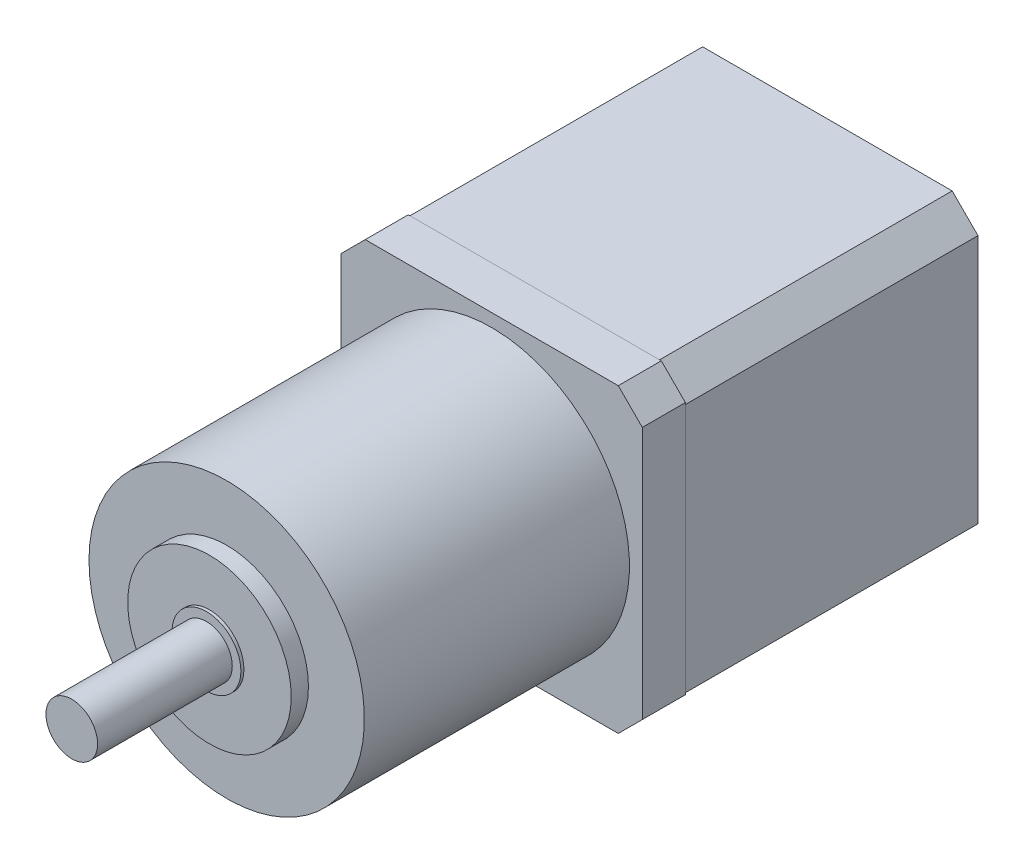
from build123d import *

# Parameters (mm, degrees)
SKETCH1_W           = 35
SKETCH1_H           = 35
BOSS_EXTRUDE1_DEPTH = 34
CHAMFER1_SIZE       = 3
SKETCH2_W           = 35
SKETCH2_H           = 35
BOSS_EXTRUDE2_DEPTH = 5
CHAMFER2_SIZE       = 2.8
SKETCH3_R           = 16
BOSS_EXTRUDE3_DEPTH = 30.8
SKETCH4_R           = 9.5
BOSS_EXTRUDE4_DEPTH = 2
SKETCH6_R           = 3
BOSS_EXTRUDE5_DEPTH = 18
SKETCH7_R           = 4
BOSS_EXTRUDE6_DEPTH = 0.35


with BuildPart() as part:
    # Sketch1 → Boss-Extrude1 (new body)
    with BuildSketch(Plane.XY):
        Rectangle(SKETCH1_W, SKETCH1_H)
    extrude(amount=BOSS_EXTRUDE1_DEPTH)

    # Chamfer1
    chamfer1_edges = [part.edges().sort_by_distance(p)[0] for p in [
        (17.5, -17.5, 17),
        (-17.5, -17.5, 17),
        (-17.5, 17.5, 17),
        (17.5, 17.5, 17),
    ]]
    chamfer(chamfer1_edges, length=CHAMFER1_SIZE)


with BuildPart() as body_2:
    # Sketch2 → Boss-Extrude2 (new body)
    with BuildSketch(Plane.XY.offset(34)):
        Rectangle(SKETCH2_W, SKETCH2_H)
    extrude(amount=BOSS_EXTRUDE2_DEPTH)

    # Chamfer2
    chamfer2_edges = [body_2.edges().sort_by_distance(p)[0] for p in [
        (17.5, -17.5, 36.5),
        (-17.5, -17.5, 36.5),
        (-17.5, 17.5, 36.5),
        (17.5, 17.5, 36.5),
    ]]
    chamfer(chamfer2_edges, length=CHAMFER2_SIZE)

    # Sketch3 → Boss-Extrude3 (add)
    with BuildSketch(Plane.XY.offset(39)):
        with Locations(Location((0, 0, 0), (0, 0, 180))):
            Circle(SKETCH3_R)
    extrude(amount=BOSS_EXTRUDE3_DEPTH)

    # Sketch4 → Boss-Extrude4 (add)
    with BuildSketch(Plane.XY.offset(69.8)):
        Circle(SKETCH4_R)
    extrude(amount=BOSS_EXTRUDE4_DEPTH)

    # Sketch6 → Boss-Extrude5 (add)
    with BuildSketch(Plane.XY.offset(69.8)):
        Circle(SKETCH6_R)
    extrude(amount=BOSS_EXTRUDE5_DEPTH)

    # Sketch7 → Boss-Extrude6 (add)
    with BuildSketch(Plane.XY.offset(71.8)):
        Circle(SKETCH7_R)
    extrude(amount=BOSS_EXTRUDE6_DEPTH)


solid = Compound([part.part, body_2.part])
